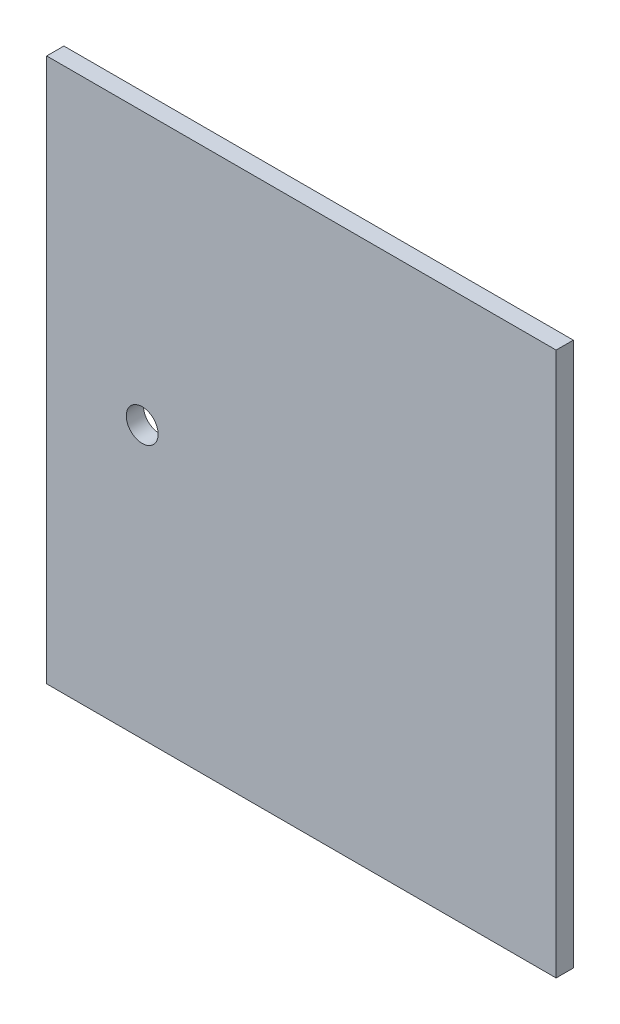
from build123d import *

# Parameters (mm, degrees)
CROQUIS1_W              = 80
CROQUIS1_H              = 85.4
SALIENTE_EXTRUIR1_DEPTH = 2.7
CROQUIS2_R              = 2.5
CORTAR_EXTRUIR1_DEPTH   = 2.7


with BuildPart() as part:
    # Croquis1 → Saliente-Extruir1 (new body)
    with BuildSketch(Plane.XY):
        with Locations((-42.7, 42.7)):
            Rectangle(CROQUIS1_W, CROQUIS1_H)
    extrude(amount=SALIENTE_EXTRUIR1_DEPTH)

    # Croquis2 → Cortar-Extruir1 (cut)
    with BuildSketch(Plane.XY.offset(2.7)):
        with Locations((-67.7, 42.7)):
            Circle(CROQUIS2_R)
    extrude(amount=-CORTAR_EXTRUIR1_DEPTH, mode=Mode.SUBTRACT)


solid = part.part
